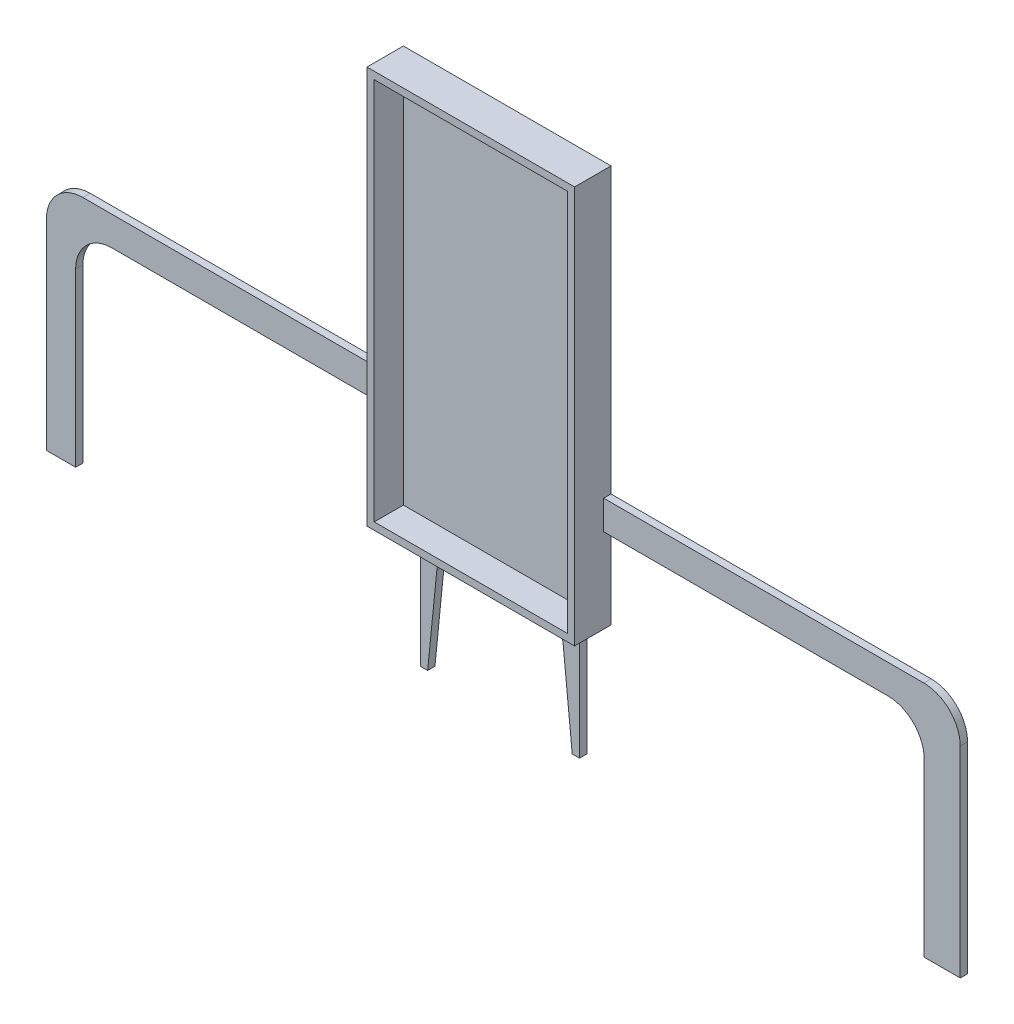
from build123d import *

# Parameters (mm, degrees)
BOSS_EXTRU_1_DEPTH = 1
ESQUISSE2_W        = 28.5
ESQUISSE2_H        = 54.569597512
ESQUISSE2_W_2      = 26.5
ESQUISSE2_H_2      = 52.569597512
BOSS_EXTRU_2_DEPTH = 4


with BuildPart() as part:
    # Esquisse1 → Boss.-Extru.1 (new body)
    with BuildSketch(Plane.XY):
        with BuildLine():
            Line((0, 27.569597512), (0, 0))
            Line((0, 0), (4, 0))
            Line((4, 0), (4, 23.569597512))
            ThreePointArc((4, 23.569597512), (5.464466094, 27.105131417), (9, 28.569597512))
            Line((9, 28.569597512), (47.9850382, 28.569597512))
            Line((47.9850382, 28.569597512), (47.9850382, 17))
            Line((47.9850382, 17), (51.319537583, 17))
            Line((51.319537583, 17), (51.319537583, 0))
            Line((51.319537583, 0), (52.319537583, 0))
            Line((52.319537583, 0), (53.567879902, 12.496984059))
            ThreePointArc((53.567879902, 12.496984059), (55.187893525, 15.707082431), (58.543119277, 17))
            Line((58.543119277, 17), (65.935302341, 17))
            ThreePointArc((65.935302341, 17), (69.290528094, 15.707082431), (70.910541717, 12.496984059))
            Line((70.910541717, 12.496984059), (72.158884036, 0))
            Line((72.158884036, 0), (73.158884036, 0))
            Line((73.158884036, 0), (73.158884036, 17))
            Line((73.158884036, 17), (76.4850382, 17))
            Line((76.4850382, 17), (76.4850382, 28.569597512))
            Line((76.4850382, 28.569597512), (115.4700764, 28.569597512))
            ThreePointArc((115.4700764, 28.569597512), (119.005610306, 27.105131417), (120.4700764, 23.569597512))
            Line((120.4700764, 23.569597512), (120.4700764, 0))
            Line((120.4700764, 0), (125.415873255, 0))
            Line((125.415873255, 0), (125.415873255, 27.569597512))
            ThreePointArc((125.415873255, 27.569597512), (123.951407161, 31.105131417), (120.415873255, 32.569597512))
            Line((120.415873255, 32.569597512), (76.4850382, 32.569597512))
            Line((76.4850382, 32.569597512), (76.4850382, 71.569597512))
            Line((76.4850382, 71.569597512), (47.9850382, 71.569597512))
            Line((47.9850382, 71.569597512), (47.9850382, 32.569597512))
            Line((47.9850382, 32.569597512), (5, 32.569597512))
            ThreePointArc((5, 32.569597512), (1.464466094, 31.105131417), (0, 27.569597512))
        make_face()
    extrude(amount=BOSS_EXTRU_1_DEPTH)

    # Esquisse2 → Boss.-Extru.2 (add)
    with BuildSketch(Plane.XY.offset(1)):
        with Locations((62.2350382, 44.284798756)):
            Rectangle(ESQUISSE2_W, ESQUISSE2_H)
        with Locations((62.2350382, 44.284798756)):
            Rectangle(ESQUISSE2_W_2, ESQUISSE2_H_2, mode=Mode.SUBTRACT)
    extrude(amount=BOSS_EXTRU_2_DEPTH)


solid = part.part
